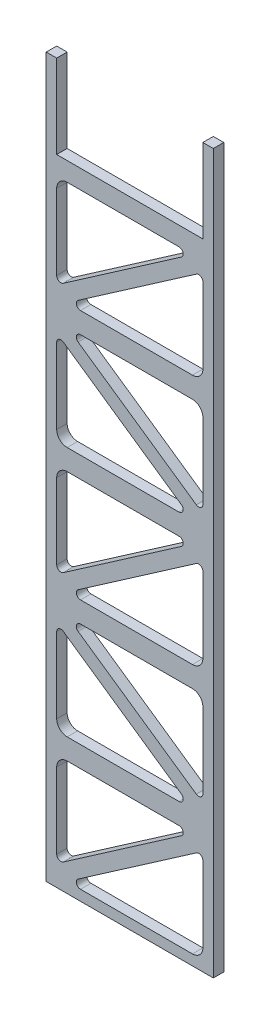
from build123d import *

# Parameters (mm, degrees)
BOSS_EXTRUDE1_DEPTH = 6.35


with BuildPart() as part:
    # Model → Boss-Extrude1 (new body)
    with BuildSketch(Plane.XY):
        Polygon((-95.25, 386.08), (-6.35, 386.08), (-6.35, 436.88), (0, 436.88), (0, 0), (-101.6, 0), (-101.6, 436.88), (-95.25, 436.88), align=None)
        with BuildLine():
            Line((-80.76878597, 311.15), (-12.7, 311.15))
            ThreePointArc((-12.7, 311.15), (-8.209871939, 313.009871939), (-6.35, 317.5))
            Line((-6.35, 317.5), (-6.35, 363.45223644))
            ThreePointArc((-6.35, 363.45223644), (-7.711169032, 365.702115893), (-10.335793346, 365.540604607))
            Line((-10.335793346, 365.540604607), (-82.214579316, 315.778368167))
            ThreePointArc((-82.214579316, 315.778368167), (-83.193250358, 312.932654354), (-80.76878597, 311.15))
        make_face(mode=Mode.SUBTRACT)
        with BuildLine():
            Line((-95.25, 287.25223644), (-95.25, 241.3))
            ThreePointArc((-95.25, 241.3), (-93.390128061, 236.809871939), (-88.9, 234.95))
            Line((-88.9, 234.95), (-20.83121403, 234.95))
            ThreePointArc((-20.83121403, 234.95), (-18.406749642, 236.732654354), (-19.385420684, 239.578368167))
            Line((-19.385420684, 239.578368167), (-91.264206654, 289.340604607))
            ThreePointArc((-91.264206654, 289.340604607), (-93.888830968, 289.502115893), (-95.25, 287.25223644))
        make_face(mode=Mode.SUBTRACT)
        with BuildLine():
            Line((-80.76878597, 158.75), (-12.7, 158.75))
            ThreePointArc((-12.7, 158.75), (-8.209871939, 160.609871939), (-6.35, 165.1))
            Line((-6.35, 165.1), (-6.35, 211.05223644))
            ThreePointArc((-6.35, 211.05223644), (-7.711169032, 213.302115893), (-10.335793346, 213.140604607))
            Line((-10.335793346, 213.140604607), (-82.214579316, 163.378368167))
            ThreePointArc((-82.214579316, 163.378368167), (-83.193250358, 160.532654354), (-80.76878597, 158.75))
        make_face(mode=Mode.SUBTRACT)
        with BuildLine():
            Line((-20.83121403, 222.25), (-88.9, 222.25))
            ThreePointArc((-88.9, 222.25), (-93.390128061, 220.390128061), (-95.25, 215.9))
            Line((-95.25, 215.9), (-95.25, 169.94776356))
            ThreePointArc((-95.25, 169.94776356), (-93.888830968, 167.697884107), (-91.264206654, 167.859395393))
            Line((-91.264206654, 167.859395393), (-19.385420684, 217.621631833))
            ThreePointArc((-19.385420684, 217.621631833), (-18.406749642, 220.467345646), (-20.83121403, 222.25))
        make_face(mode=Mode.SUBTRACT)
        with BuildLine():
            Line((-82.214579316, 293.821631833), (-10.335793346, 244.059395393))
            ThreePointArc((-10.335793346, 244.059395393), (-7.711169032, 243.897884107), (-6.35, 246.14776356))
            Line((-6.35, 246.14776356), (-6.35, 292.1))
            ThreePointArc((-6.35, 292.1), (-8.209871939, 296.590128061), (-12.7, 298.45))
            Line((-12.7, 298.45), (-80.76878597, 298.45))
            ThreePointArc((-80.76878597, 298.45), (-83.193250358, 296.667345646), (-82.214579316, 293.821631833))
        make_face(mode=Mode.SUBTRACT)
        with BuildLine():
            Line((-95.25, 134.85223644), (-95.25, 88.9))
            ThreePointArc((-95.25, 88.9), (-93.390128061, 84.409871939), (-88.9, 82.55))
            Line((-88.9, 82.55), (-20.83121403, 82.55))
            ThreePointArc((-20.83121403, 82.55), (-18.406749642, 84.332654354), (-19.385420684, 87.178368167))
            Line((-19.385420684, 87.178368167), (-91.264206654, 136.940604607))
            ThreePointArc((-91.264206654, 136.940604607), (-93.888830968, 137.102115893), (-95.25, 134.85223644))
        make_face(mode=Mode.SUBTRACT)
        with BuildLine():
            Line((-80.76878597, 6.35), (-12.7, 6.35))
            ThreePointArc((-12.7, 6.35), (-8.209871939, 8.209871939), (-6.35, 12.7))
            Line((-6.35, 12.7), (-6.35, 58.65223644))
            ThreePointArc((-6.35, 58.65223644), (-7.711169032, 60.902115893), (-10.335793346, 60.740604607))
            Line((-10.335793346, 60.740604607), (-82.214579316, 10.978368167))
            ThreePointArc((-82.214579316, 10.978368167), (-83.193250358, 8.132654354), (-80.76878597, 6.35))
        make_face(mode=Mode.SUBTRACT)
        with BuildLine():
            Line((-20.83121403, 69.85), (-88.9, 69.85))
            ThreePointArc((-88.9, 69.85), (-93.390128061, 67.990128061), (-95.25, 63.5))
            Line((-95.25, 63.5), (-95.25, 17.54776356))
            ThreePointArc((-95.25, 17.54776356), (-93.888830968, 15.297884107), (-91.264206654, 15.459395393))
            Line((-91.264206654, 15.459395393), (-19.385420684, 65.221631833))
            ThreePointArc((-19.385420684, 65.221631833), (-18.406749642, 68.067345646), (-20.83121403, 69.85))
        make_face(mode=Mode.SUBTRACT)
        with BuildLine():
            Line((-20.83121403, 374.65), (-88.9, 374.65))
            ThreePointArc((-88.9, 374.65), (-93.390128061, 372.790128061), (-95.25, 368.3))
            Line((-95.25, 368.3), (-95.25, 322.34776356))
            ThreePointArc((-95.25, 322.34776356), (-93.888830968, 320.097884107), (-91.264206654, 320.259395393))
            Line((-91.264206654, 320.259395393), (-19.385420684, 370.021631833))
            ThreePointArc((-19.385420684, 370.021631833), (-18.406749642, 372.867345646), (-20.83121403, 374.65))
        make_face(mode=Mode.SUBTRACT)
        with BuildLine():
            Line((-82.214579316, 141.421631833), (-10.335793346, 91.659395393))
            ThreePointArc((-10.335793346, 91.659395393), (-7.711169032, 91.497884107), (-6.35, 93.74776356))
            Line((-6.35, 93.74776356), (-6.35, 139.7))
            ThreePointArc((-6.35, 139.7), (-8.209871939, 144.190128061), (-12.7, 146.05))
            Line((-12.7, 146.05), (-80.76878597, 146.05))
            ThreePointArc((-80.76878597, 146.05), (-83.193250358, 144.267345646), (-82.214579316, 141.421631833))
        make_face(mode=Mode.SUBTRACT)
    extrude(amount=BOSS_EXTRUDE1_DEPTH)


solid = part.part
